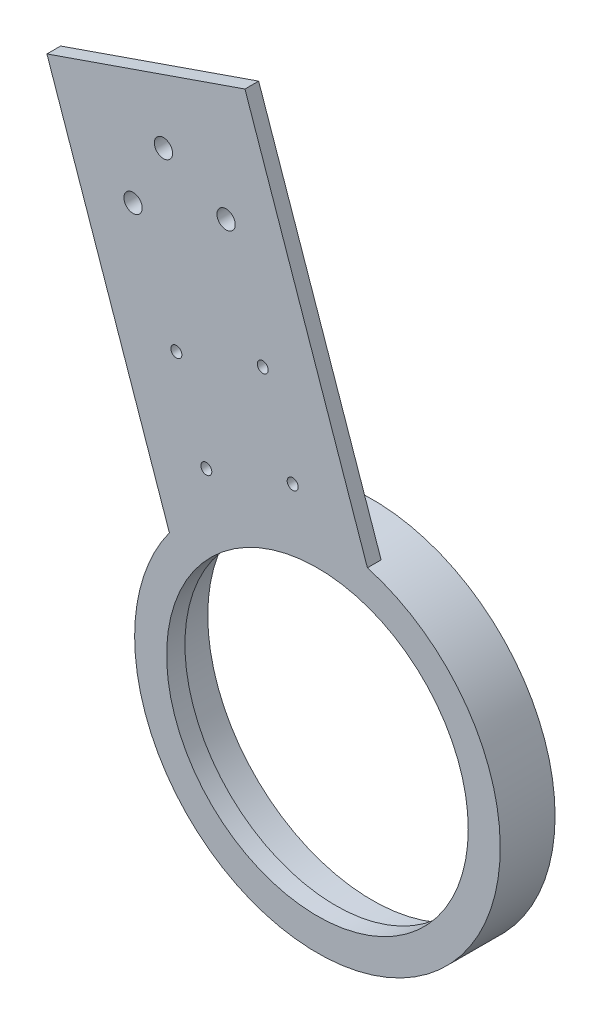
from build123d import *

# Parameters (mm, degrees)
SKETCH_1_R          = 40
SKETCH_1_R_2        = 33
EXTRUDE_1_DEPTH     = 4
EXTRUDE_START       = 8
SKETCH_2_R          = 40
SKETCH_2_R_2        = 36
EXTRUDE_2_DEPTH     = 8
EXTRUDE_3_DEPTH     = 3
SKETCH_6_R          = 2
CUT_EXTRUDE_1_DEPTH = 3
SKETCH_7_R          = 1.2
CUT_EXTRUDE_2_DEPTH = 5


with BuildPart() as part:
    # 草图1 → 凸台-拉伸1 (new body)
    with BuildSketch(Plane.XY):
        with Locations((-86.606649797, -63.783530386)):
            Circle(SKETCH_1_R)
        with Locations((-86.606649797, -63.783530386)):
            Circle(SKETCH_1_R_2, mode=Mode.SUBTRACT)
    extrude(amount=EXTRUDE_1_DEPTH)

    # 草图2 → 凸台-拉伸2 (add)
    with BuildSketch(Plane(origin=(0, 0, 0), x_dir=(-1, 0, 0), z_dir=(0, 0, -1)).offset(EXTRUDE_START)):
        with Locations((86.606649797, -63.783530386)):
            Circle(SKETCH_2_R)
        with Locations((86.606649797, -63.783530386)):
            Circle(SKETCH_2_R_2, mode=Mode.SUBTRACT)
    extrude(amount=-EXTRUDE_2_DEPTH)

    # 草图4 → 凸台-拉伸3 (add)
    with BuildSketch(Plane.XY.offset(4)):
        with BuildLine():
            Line((-102.470674133, 52.025849932), (-145.802574452, 37.009933401))
            Line((-145.802574452, 37.009933401), (-118.238289751, -42.533185695))
            ThreePointArc((-118.238289751, -42.533185695), (-99.084005703, -27.777233919), (-74.906389432, -27.517269163))
            Line((-74.906389432, -27.517269163), (-102.470674133, 52.025849932))
        make_face()
    extrude(amount=-EXTRUDE_3_DEPTH)

    # 草图6 → 切除-拉伸1 (cut)
    with BuildSketch(Plane(origin=(0, 0, 1), x_dir=(-1, 0, 0), z_dir=(0, 0, -1))):
        with Locations((120.302459735, 31.916433112)):
            Circle(SKETCH_6_R)
        with Locations((126.956233046, 18.205691171)):
            Circle(SKETCH_6_R)
        with Locations((106.591717794, 25.262659801)):
            Circle(SKETCH_6_R)
    extrude(amount=-CUT_EXTRUDE_1_DEPTH, mode=Mode.SUBTRACT)

    # 草图7 → 切除-拉伸2 (cut)
    with BuildSketch(Plane.XY.offset(4)):
        with Locations((-117.474470724, -5.248159683)):
            Circle(SKETCH_7_R)
        with Locations((-110.925868003, -24.145667519)):
            Circle(SKETCH_7_R)
        with Locations((-98.576962888, 1.300443037)):
            Circle(SKETCH_7_R)
        with Locations((-92.028360167, -17.597064799)):
            Circle(SKETCH_7_R)
    extrude(amount=-CUT_EXTRUDE_2_DEPTH, mode=Mode.SUBTRACT)


solid = part.part
